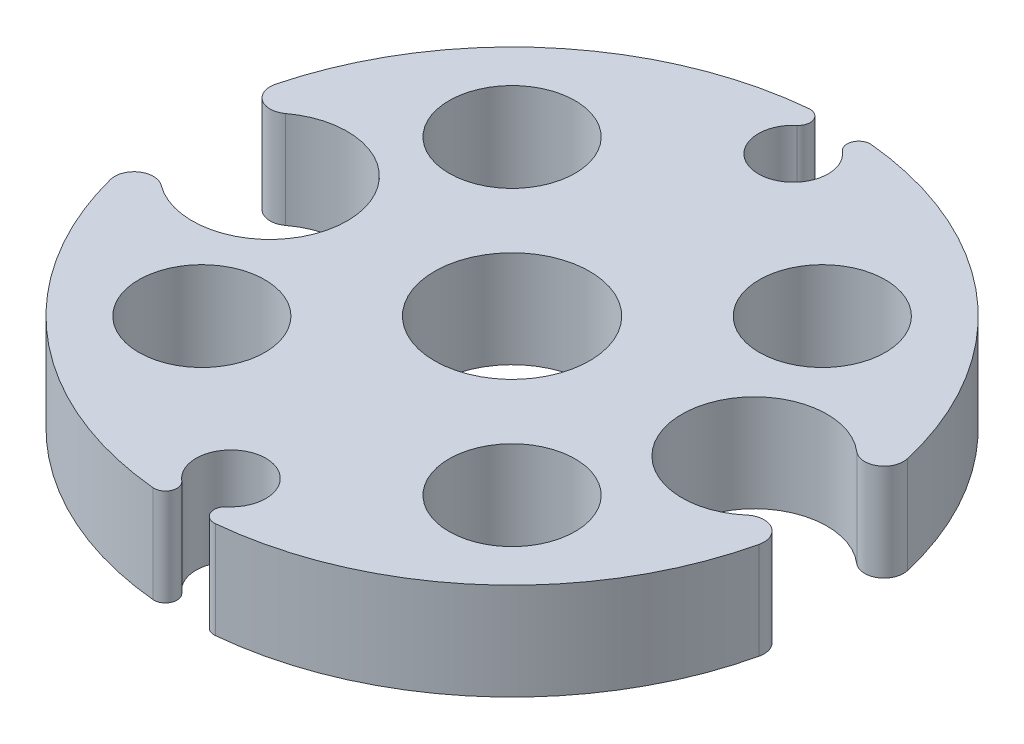
from build123d import *

# Parameters (mm, degrees)
SKETCH2_R           = 3.25
SKETCH2_R_2         = 4
BOSS_EXTRUDE1_DEPTH = 5


with BuildPart() as part:
    # Sketch2 → Boss-Extrude1 (new body)
    with BuildSketch(Plane(origin=(0, 0, 0), x_dir=(1, 0, 0), z_dir=(0, 1, 0))):
        with BuildLine():
            ThreePointArc((74.0754883, 100.6287171), (72.919899742, 100.600095739), (72.5093633, 101.680680732))
            ThreePointArc((72.5093633, 101.680680732), (77.933093033, 110.354945232), (87.35286635, 114.345882401))
            ThreePointArc((87.35286635, 114.345882401), (87.962324772, 113.982635249), (87.79926183, 113.292129247))
            ThreePointArc((87.79926183, 113.292129247), (88.97179336, 110.122737844), (90.12915105, 113.29770166))
            ThreePointArc((90.12915105, 113.29770166), (89.96425768, 113.984397711), (90.570273688, 114.34700754))
            ThreePointArc((90.570273688, 114.34700754), (100.167880321, 110.211447196), (105.532711055, 101.242862936))
            ThreePointArc((105.532711055, 101.242862936), (105.075581876, 100.162342656), (103.906399753, 100.259832785))
            ThreePointArc((103.906399753, 100.259832785), (97.726174894, 97.422732696), (103.906399753, 94.585632606))
            ThreePointArc((103.906399753, 94.585632606), (105.075581876, 94.683122735), (105.532711055, 93.602602455))
            ThreePointArc((105.532711055, 93.602602455), (100.172351893, 84.637935793), (90.582110249, 80.49958299))
            ThreePointArc((90.582110249, 80.49958299), (89.972651827, 80.862830142), (90.135714769, 81.553336144))
            ThreePointArc((90.135714769, 81.553336144), (88.963183239, 84.722727547), (87.805825549, 81.547763731))
            ThreePointArc((87.805825549, 81.547763731), (87.97071892, 80.86106768), (87.364702911, 80.498457852))
            ThreePointArc((87.364702911, 80.498457852), (77.937616147, 84.486662184), (72.5093633, 93.164784659))
            ThreePointArc((72.5093633, 93.164784659), (72.919899742, 94.245369652), (74.0754883, 94.216748291))
            ThreePointArc((74.0754883, 94.216748291), (80.4674883, 97.422732696), (74.0754883, 100.6287171))
        make_face()
        with Locations(Location((80.9674883, 89.422732696, 0), (0, 0, 270))):
            Circle(SKETCH2_R, mode=Mode.SUBTRACT)
        with Locations(Location((88.9674883, 97.422732696, 0), (0, 0, 270))):
            Circle(SKETCH2_R_2, mode=Mode.SUBTRACT)
        with Locations(Location((80.9674883, 105.422732696, 0), (0, 0, 270))):
            Circle(SKETCH2_R, mode=Mode.SUBTRACT)
        with Locations(Location((96.9674883, 105.422732696, 0), (0, 0, 270))):
            Circle(SKETCH2_R, mode=Mode.SUBTRACT)
        with Locations(Location((96.9674883, 89.422732696, 0), (0, 0, 270))):
            Circle(SKETCH2_R, mode=Mode.SUBTRACT)
    extrude(amount=BOSS_EXTRUDE1_DEPTH)


solid = part.part
